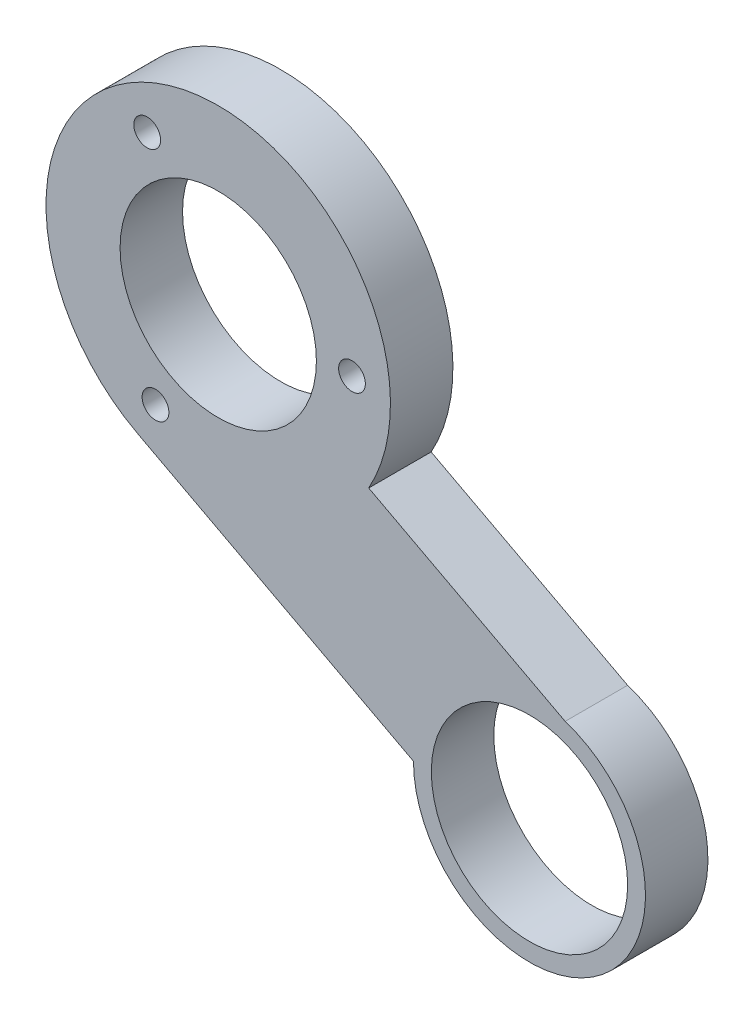
from build123d import *

# Parameters (mm, degrees)
SKETCH1_R           = 1.5
SKETCH1_R_2         = 11
BOSS_EXTRUDE1_DEPTH = 7


with BuildPart() as part:
    # Sketch1 → Boss-Extrude1 (new body)
    with BuildSketch(Plane.XY):
        with BuildLine():
            Line((24.749447939, -15.649541482), (2.734486559, -4.010388703))
            ThreePointArc((2.734486559, -4.010388703), (-19.612688755, 23.883391477), (-23.148073161, -11.682888541))
            Line((-23.148073161, -11.682888541), (7.752714707, -28.019914292))
            ThreePointArc((7.752714707, -28.019914292), (28.40263196, -38.530802267), (24.749447939, -15.649541482))
        make_face()
        with Locations(Location((0.862954929, 5.91648973, 0), (0, 0, 180))):
            Circle(SKETCH1_R, mode=Mode.SUBTRACT)
        with Locations(Location((-21.15738061, -7.87136082, 0), (0, 0, 180))):
            Circle(SKETCH1_R, mode=Mode.SUBTRACT)
        with Locations(Location((-14.127422454, 5.37928778, 0), (0, 0, 180))):
            Circle(SKETCH1_R_2, mode=Mode.SUBTRACT)
        with Locations(Location((-22.08784168, 18.092734431, 0), (0, 0, 180))):
            Circle(SKETCH1_R, mode=Mode.SUBTRACT)
        with Locations(Location((20.752714707, -28.019914292, 0), (0, 0, 180))):
            Circle(SKETCH1_R_2, mode=Mode.SUBTRACT)
    extrude(amount=BOSS_EXTRUDE1_DEPTH)


solid = part.part
